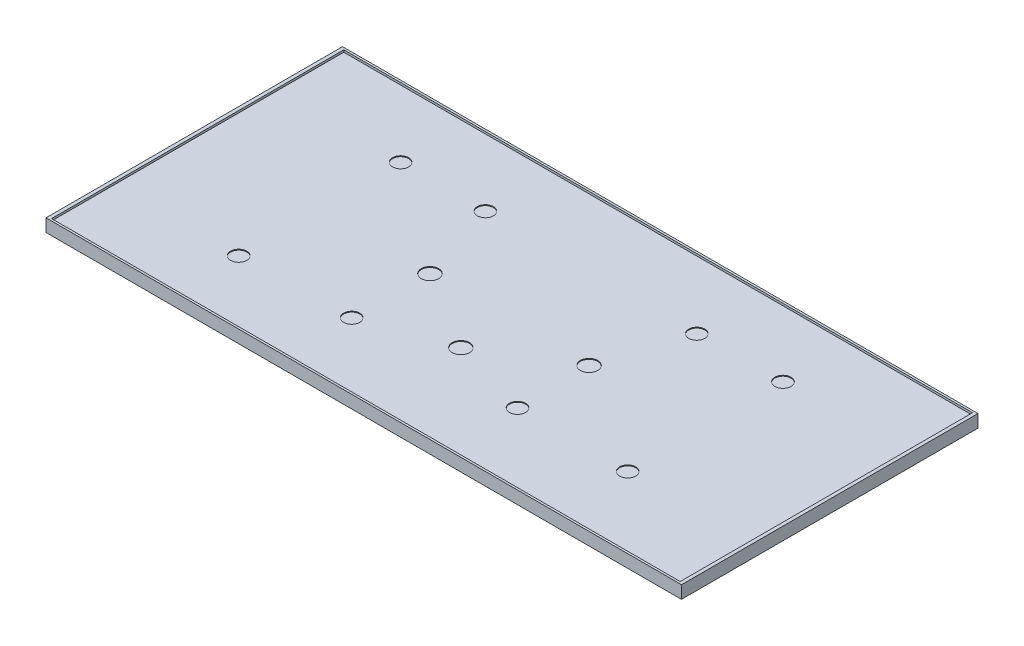
from build123d import *

# Parameters (mm, degrees)
SKETCH2_W           = 1500
SKETCH2_H           = 700
BOSS_EXTRUDE1_DEPTH = 30
SKETCH3_W           = 1484
SKETCH3_H           = 690
CUT_EXTRUDE2_DEPTH  = 5
SKETCH9_R           = 19
SKETCH9_R_2         = 20.5
CUT_EXTRUDE3_DEPTH  = 2


with BuildPart() as part:
    # Sketch2 → Boss-Extrude1 (new body)
    with BuildSketch(Plane(origin=(0, 0, 0), x_dir=(1, 0, 0), z_dir=(0, 1, 0))):
        with Locations((447.272601934, 133.030337178)):
            Rectangle(SKETCH2_W, SKETCH2_H)
    extrude(amount=BOSS_EXTRUDE1_DEPTH)

    # Sketch3 → Cut-Extrude2 (cut)
    with BuildSketch(Plane(origin=(0, 30, 0), x_dir=(1, 0, 0), z_dir=(0, 1, 0))):
        with Locations((447.272601934, 133.030337178)):
            Rectangle(SKETCH3_W, SKETCH3_H)
    extrude(amount=-CUT_EXTRUDE2_DEPTH, mode=Mode.SUBTRACT)

    # Sketch9 → Cut-Extrude3 (cut)
    with BuildSketch(Plane(origin=(0, 25, 0), x_dir=(1, 0, 0), z_dir=(0, 1, 0))):
        with Locations(Location((197.272601934, 320.105430206, 0), (0, 0, 270))):
            Circle(SKETCH9_R)
        with Locations(Location((697.300508301, 319.270199385, 0), (0, 0, 270))):
            Circle(SKETCH9_R)
        with Locations(Location((257.272601934, -55.377603043, 0), (0, 0, 270))):
            Circle(SKETCH9_R)
        with Locations(Location((637.272601934, -43.882638763, 0), (0, 0, 270))):
            Circle(SKETCH9_R)
        with Locations(Location((259.572601934, 127.154489334, 0), (0, 0, 270))):
            Circle(SKETCH9_R_2)
        with Locations(Location((634.954920993, 127.154489334, 0), (0, 0, 270))):
            Circle(SKETCH9_R_2)
        with Locations(Location((447.263761463, 12.385030703, 0), (0, 0, 270))):
            Circle(SKETCH9_R_2)
        with Locations(Location((-2.727398066, 320.105430206, 0), (0, 0, 270))):
            Circle(SKETCH9_R)
        with Locations(Location((-2.727398066, -61.969662822, 0), (0, 0, 270))):
            Circle(SKETCH9_R)
        with Locations(Location((897.272601934, 322.611122669, 0), (0, 0, 270))):
            Circle(SKETCH9_R)
        with Locations(Location((897.272601934, -43.882638763, 0), (0, 0, 270))):
            Circle(SKETCH9_R)
    extrude(amount=-CUT_EXTRUDE3_DEPTH, mode=Mode.SUBTRACT)


solid = part.part
